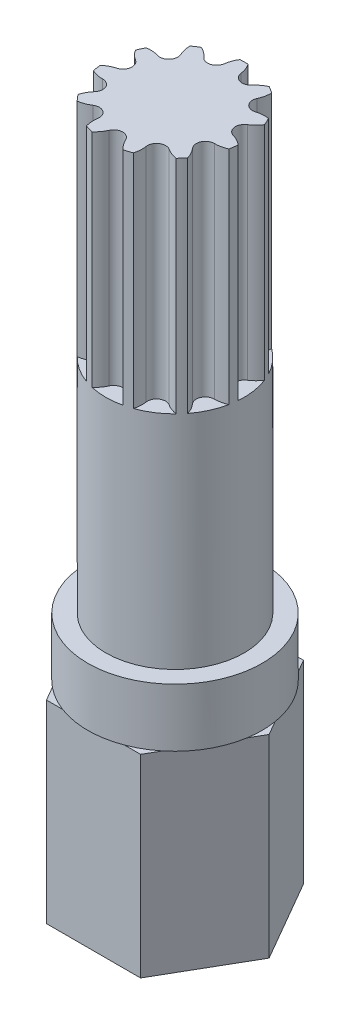
from build123d import *

# Parameters (mm, degrees)
SKETCH1_R           = 3.15
BOSS_EXTRUDE1_DEPTH = 2.1
SKETCH2_R           = 2.5
BOSS_EXTRUDE3_DEPTH = 16
SKETCH8_OUTSIDE_W   = 12.334
SKETCH8_OUTSIDE_H   = 12.334
CUT_EXTRUDE5_DEPTH  = 8
BOSS_EXTRUDE4_DEPTH = 7


with BuildPart() as part:
    # Sketch1 → Boss-Extrude1 (new body)
    with BuildSketch(Plane(origin=(0, 0, 0), x_dir=(1, 0, 0), z_dir=(0, 1, 0))):
        with Locations(Location((0, 0, 0), (0, 0, 270))):
            Circle(SKETCH1_R)
    extrude(amount=BOSS_EXTRUDE1_DEPTH)

    # Sketch2 → Boss-Extrude3 (add)
    with BuildSketch(Plane(origin=(0, 2.1, 0), x_dir=(1, 0, 0), z_dir=(0, 1, 0))):
        with Locations(Location((0, 0, 0), (0, 0, 270))):
            Circle(SKETCH2_R)
    extrude(amount=BOSS_EXTRUDE3_DEPTH)

    # Sketch8 outside → Cut-Extrude5 (cut)
    with BuildSketch(Plane(origin=(0, 18.1, 0), x_dir=(1, 0, 0), z_dir=(0, 1, 0))):
        Rectangle(SKETCH8_OUTSIDE_W, SKETCH8_OUTSIDE_H)
        with BuildLine():
            ThreePointArc((-0.874874584, -1.914509945), (-0.872847435, -1.898524314), (-0.871608771, -1.882458342))
            ThreePointArc((-0.871608771, -1.882458342), (-1.021648634, -1.589716304), (-1.350264969, -1.574844682))
            ThreePointArc((-1.350264969, -1.574844682), (-1.364364531, -1.582645457), (-1.378063464, -1.591130087))
            ThreePointArc((-1.378063464, -1.591130087), (-1.575187068, -1.691186219), (-1.789333192, -1.746053167))
            ThreePointArc((-1.789333192, -1.746053167), (-1.889436652, -1.637206179), (-1.982929527, -1.522631086))
            ThreePointArc((-1.982929527, -1.522631086), (-1.898144875, -1.318473041), (-1.771053556, -1.137595344))
            ThreePointArc((-1.771053556, -1.137595344), (-1.760705725, -1.125243335), (-1.750977775, -1.112397452))
            ThreePointArc((-1.750977775, -1.112397452), (-1.718931045, -0.785009505), (-1.987340492, -0.594835296))
            ThreePointArc((-1.987340492, -0.594835296), (-2.003419215, -0.593774926), (-2.019530629, -0.593506449))
            ThreePointArc((-2.019530629, -0.593506449), (-2.239455986, -0.571105958), (-2.449270481, -0.501486836))
            ThreePointArc((-2.449270481, -0.501486836), (-2.474635746, -0.355798906), (-2.491342985, -0.20886614))
            ThreePointArc((-2.491342985, -0.20886614), (-2.309641425, -0.082955507), (-2.104935538, 0.00049774))
            ThreePointArc((-2.104935538, 0.00049774), (-2.089552388, 0.005294452), (-2.074423707, 0.010841769))
            ThreePointArc((-2.074423707, 0.010841769), (-1.870464994, 0.268932266), (-1.99344945, 0.574030094))
            ThreePointArc((-1.99344945, 0.574030094), (-2.006402454, 0.583614948), (-2.019811088, 0.592551293))
            ThreePointArc((-2.019811088, 0.592551293), (-2.192713451, 0.73029641), (-2.331581698, 0.902298023))
            ThreePointArc((-2.331581698, 0.902298023), (-2.274155475, 1.038572006), (-2.208772648, 1.17121233))
            ThreePointArc((-2.208772648, 1.17121233), (-1.987843141, 1.178899814), (-1.770515359, 1.138432796))
            ThreePointArc((-1.770515359, 1.138432796), (-1.754980932, 1.134151287), (-1.739254769, 1.130638805))
            ThreePointArc((-1.739254769, 1.130638805), (-1.428139525, 1.237489942), (-1.366652294, 1.560644985))
            ThreePointArc((-1.366652294, 1.560644985), (-1.37236709, 1.5757112), (-1.378815798, 1.590478186))
            ThreePointArc((-1.378815798, 1.590478186), (-1.449799889, 1.799834828), (-1.4736322, 2.019609634))
            ThreePointArc((-1.4736322, 2.019609634), (-1.351646909, 2.103203644), (-1.224932602, 2.179439161))
            ThreePointArc((-1.224932602, 2.179439161), (-1.034918706, 2.066462775), (-0.873969064, 1.914923482))
            ThreePointArc((-0.873969064, 1.914923482), (-0.86321543, 1.902923103), (-0.851884731, 1.891466009))
            ThreePointArc((-0.851884731, 1.891466009), (-0.532389846, 1.813153306), (-0.30595269, 2.05176612))
            ThreePointArc((-0.30595269, 2.05176612), (-0.302614872, 2.067530279), (-0.300056235, 2.083439494))
            ThreePointArc((-0.300056235, 2.083439494), (-0.246585106, 2.297938405), (-0.14781489, 2.495709457))
            ThreePointArc((-0.14781489, 2.495709457), (-0.073939789, 2.498989364), (0, 2.500082986))
            ThreePointArc((0, 2.500082986), (0.073939789, 2.498989364), (0.14781489, 2.495709457))
            ThreePointArc((0.14781489, 2.495709457), (0.246585106, 2.297938405), (0.300056235, 2.083439494))
            ThreePointArc((0.300056235, 2.083439494), (0.302614872, 2.067530279), (0.30595269, 2.05176612))
            ThreePointArc((0.30595269, 2.05176612), (0.532389846, 1.813153306), (0.851884731, 1.891466009))
            ThreePointArc((0.851884731, 1.891466009), (0.86321543, 1.902923103), (0.873969064, 1.914923482))
            ThreePointArc((0.873969064, 1.914923482), (1.034918706, 2.066462775), (1.224932602, 2.179439161))
            ThreePointArc((1.224932602, 2.179439161), (1.351646909, 2.103203644), (1.4736322, 2.019609634))
            ThreePointArc((1.4736322, 2.019609634), (1.449799889, 1.799834828), (1.378815798, 1.590478186))
            ThreePointArc((1.378815798, 1.590478186), (1.37236709, 1.5757112), (1.366652294, 1.560644985))
            ThreePointArc((1.366652294, 1.560644985), (1.428139525, 1.237489942), (1.739254769, 1.130638805))
            ThreePointArc((1.739254769, 1.130638805), (1.754980932, 1.134151287), (1.770515359, 1.138432796))
            ThreePointArc((1.770515359, 1.138432796), (1.987843141, 1.178899814), (2.208772648, 1.17121233))
            ThreePointArc((2.208772648, 1.17121233), (2.274155475, 1.038572006), (2.331581698, 0.902298023))
            ThreePointArc((2.331581698, 0.902298023), (2.192713451, 0.73029641), (2.019811088, 0.592551293))
            ThreePointArc((2.019811088, 0.592551293), (2.006402454, 0.583614948), (1.99344945, 0.574030094))
            ThreePointArc((1.99344945, 0.574030094), (1.870464994, 0.268932266), (2.074423707, 0.010841769))
            ThreePointArc((2.074423707, 0.010841769), (2.089552388, 0.005294452), (2.104935538, 0.00049774))
            ThreePointArc((2.104935538, 0.00049774), (2.309641425, -0.082955507), (2.491342985, -0.20886614))
            ThreePointArc((2.491342985, -0.20886614), (2.474635746, -0.355798906), (2.449270481, -0.501486836))
            ThreePointArc((2.449270481, -0.501486836), (2.239455986, -0.571105958), (2.019530629, -0.593506449))
            ThreePointArc((2.019530629, -0.593506449), (2.003419215, -0.593774926), (1.987340492, -0.594835296))
            ThreePointArc((1.987340492, -0.594835296), (1.718931045, -0.785009505), (1.750977775, -1.112397452))
            ThreePointArc((1.750977775, -1.112397452), (1.760705725, -1.125243335), (1.771053556, -1.137595344))
            ThreePointArc((1.771053556, -1.137595344), (1.898144875, -1.318473041), (1.982929527, -1.522631086))
            ThreePointArc((1.982929527, -1.522631086), (1.889436652, -1.637206179), (1.789333192, -1.746053167))
            ThreePointArc((1.789333192, -1.746053167), (1.575187069, -1.691186219), (1.378063467, -1.591130087))
            ThreePointArc((1.378063467, -1.591130087), (1.364364533, -1.582645456), (1.350264971, -1.574844682))
            ThreePointArc((1.350264971, -1.574844682), (1.021648634, -1.589716304), (0.871608771, -1.882458343))
            ThreePointArc((0.871608771, -1.882458343), (0.872847435, -1.898524314), (0.874874584, -1.914509946))
            ThreePointArc((0.874874584, -1.914509946), (0.884000739, -2.135384701), (0.844949955, -2.352971421))
            ThreePointArc((0.844949955, -2.352971421), (0.704354772, -2.398812058), (0.561295258, -2.436259955))
            ThreePointArc((0.561295258, -2.436259955), (0.410807386, -2.274326806), (0.299070887, -2.083581165))
            ThreePointArc((0.299070887, -2.083581165), (0.292133749, -2.069037237), (0.284489859, -2.05485201))
            ThreePointArc((0.284489859, -2.05485201), (0, -1.88969941), (-0.284489859, -2.054852009))
            ThreePointArc((-0.284489859, -2.054852009), (-0.292133749, -2.069037237), (-0.299070887, -2.083581165))
            ThreePointArc((-0.299070887, -2.083581165), (-0.410807386, -2.274326806), (-0.561295258, -2.436259955))
            ThreePointArc((-0.561295258, -2.436259955), (-0.704354772, -2.398812058), (-0.844949955, -2.352971421))
            ThreePointArc((-0.844949955, -2.352971421), (-0.884000739, -2.135384701), (-0.874874584, -1.914509945))
        make_face(mode=Mode.SUBTRACT)
    extrude(amount=-CUT_EXTRUDE5_DEPTH, mode=Mode.SUBTRACT)

    # Sketch9 → Boss-Extrude4 (add)
    with BuildSketch(Plane.XZ):
        Polygon((3.4, 0), (1.7, 2.944486373), (-1.7, 2.944486373), (-3.4, 0), (-1.7, -2.944486373), (1.7, -2.944486373), align=None)
    extrude(amount=BOSS_EXTRUDE4_DEPTH)


solid = part.part
